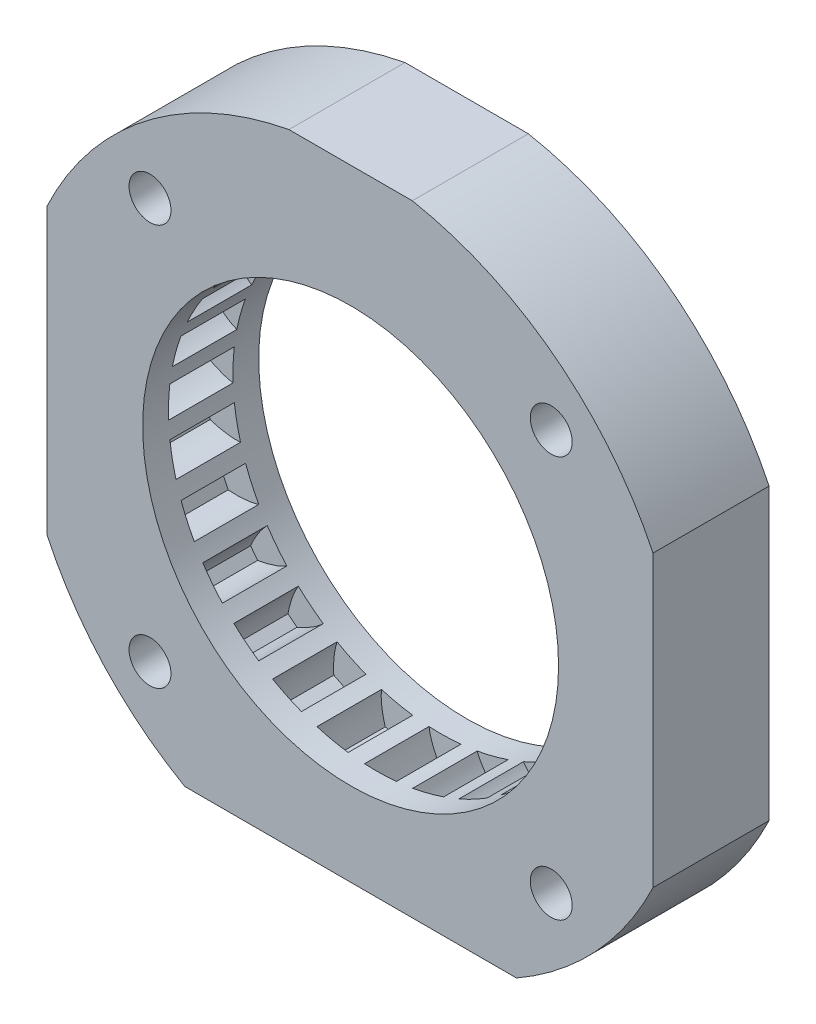
from build123d import *

# Parameters (mm, degrees)
CROQUIS77_R                 = 26
CROQUIS77_R_2               = 16.125
CROQUIS77_R_3               = 1.625
SALIENTE_EXTRUIR1_DEPTH     = 9
CORTAR_EXTRUIR34_DEPTH      = 2.5
CORTAR_EXTRUIR34_DEPTH_BACK = 2.5
CORTAR_EXTRUIR35_DEPTH      = 289.830326754
CROQUIS84_R                 = 1.625
SALIENTE_EXTRUIR2_DEPTH     = 9
CORTAR_EXTRUIR36_DEPTH      = 289.61594127


with BuildPart() as part:
    # Croquis77 → Saliente-Extruir1 (new body)
    with BuildSketch(Plane(origin=(0, -88.245525224, 0), x_dir=(1, 0, 0), z_dir=(0, 0, 1))):
        with Locations((226.61482719, 201.987096474)):
            Circle(CROQUIS77_R)
        with Locations((226.61482719, 201.987096474)):
            Circle(CROQUIS77_R_2, mode=Mode.SUBTRACT)
        with Locations((248.61482719, 201.987096474)):
            Circle(CROQUIS77_R_3, mode=Mode.SUBTRACT)
        with Locations((242.171176376, 186.430747288)):
            Circle(CROQUIS77_R_3, mode=Mode.SUBTRACT)
        with Locations((226.61482719, 179.987096474)):
            Circle(CROQUIS77_R_3, mode=Mode.SUBTRACT)
        with Locations((211.058478003, 186.430747288)):
            Circle(CROQUIS77_R_3, mode=Mode.SUBTRACT)
        with Locations((204.61482719, 201.987096474)):
            Circle(CROQUIS77_R_3, mode=Mode.SUBTRACT)
        with Locations((211.058478003, 217.54344566)):
            Circle(CROQUIS77_R_3, mode=Mode.SUBTRACT)
        with Locations((226.61482719, 223.987096474)):
            Circle(CROQUIS77_R_3, mode=Mode.SUBTRACT)
        with Locations((242.171176376, 217.54344566)):
            Circle(CROQUIS77_R_3, mode=Mode.SUBTRACT)
    extrude(amount=SALIENTE_EXTRUIR1_DEPTH)

    # Croquis80 → Cortar-Extruir34 (cut, two sides: drawn at the far end of the back side and taken through both)
    with BuildSketch(Plane(origin=(0, -88.245525224, 4.5), x_dir=(1, 0, 0), z_dir=(0, 0, 1)).offset(-CORTAR_EXTRUIR34_DEPTH_BACK)):
        with BuildLine():
            Line((209.076345498, 207.32663772), (208.83645806, 206.463797463))
            add(Edge.make_bspline(
                [(210.901865378, 205.054739598), (210.81477289, 205.090460196), (210.684168137, 205.142933934), (210.508569892, 205.226843539), (210.364583833, 205.301843923), (210.202459466, 205.393823438), (210.021733392, 205.505267626), (209.822054637, 205.639174671), (209.602681203, 205.798511697), (209.263519123, 206.066501995), (209.009024187, 206.295687384), (208.83645806, 206.463797463)],
                knots=[0, 0, 0, 0, 0.112240047, 0.167638162, 0.231904779, 0.305712064, 0.389762058, 0.484920987, 0.592209309, 0.712851342, 1, 1, 1, 1], degree=3))
            Line((210.901865378, 205.054739598), (211.57264766, 207.467445999))
            add(Edge.make_bspline(
                [(211.57264766, 207.467445999), (211.47961584, 207.481803684), (211.340668669, 207.504270956), (211.146959049, 207.523036576), (210.984923748, 207.53311646), (210.798589266, 207.538015712), (210.586275802, 207.535844644), (210.346135245, 207.524216465), (210.076000604, 207.500972808), (209.647185976, 207.446495919), (209.310917813, 207.381554891), (209.076345498, 207.32663772)],
                knots=[0, 0, 0, 0, 0.112240047, 0.167638162, 0.231904779, 0.305712064, 0.389762058, 0.484920987, 0.592209309, 0.712851342, 1, 1, 1, 1], degree=3))
        make_face()
        with BuildLine():
            Line((210.780746184, 211.227251372), (210.348340286, 210.442990936))
            add(Edge.make_bspline(
                [(212.033123177, 208.595598701), (211.956616015, 208.650441356), (211.841633006, 208.731620186), (211.690118921, 208.853763739), (211.567310305, 208.959947948), (211.430767956, 209.086836596), (211.280614176, 209.236955092), (211.117198877, 209.413301745), (210.94048433, 209.618934817), (210.672267223, 209.95791756), (210.477486019, 210.239615798), (210.348340286, 210.442990936)],
                knots=[0, 0, 0, 0, 0.112240047, 0.167638162, 0.231904779, 0.305712064, 0.389762058, 0.484920987, 0.592209309, 0.712851342, 1, 1, 1, 1], degree=3))
            Line((212.033123177, 208.595598701), (213.242232823, 210.788577249))
            add(Edge.make_bspline(
                [(213.242232823, 210.788577249), (213.155019798, 210.824002535), (213.024999275, 210.877907622), (212.840838773, 210.940839925), (212.685495736, 210.988016015), (212.505313769, 211.035754896), (212.298222559, 211.082605205), (212.061873379, 211.126670689), (211.793659897, 211.166350903), (211.363840787, 211.212233904), (211.021660344, 211.226592145), (210.780746184, 211.227251372)],
                knots=[0, 0, 0, 0, 0.112240047, 0.167638162, 0.231904779, 0.305712064, 0.389762058, 0.484920987, 0.592209309, 0.712851342, 1, 1, 1, 1], degree=3))
        make_face()
        with BuildLine():
            Line((213.338747944, 214.62966163), (212.7371347, 213.966260698))
            add(Edge.make_bspline(
                [(213.95046608, 211.780127486), (213.888668765, 211.851135616), (213.795506265, 211.956643167), (213.676244504, 212.110435877), (213.581233973, 212.242079493), (213.477634678, 212.397036674), (213.366148019, 212.577736552), (213.247805938, 212.787015919), (213.123277004, 213.027859304), (212.940464525, 213.419559845), (212.815897758, 213.738584508), (212.7371347, 213.966260698)],
                knots=[0, 0, 0, 0, 0.112240047, 0.167638162, 0.231904779, 0.305712064, 0.389762058, 0.484920987, 0.592209309, 0.712851342, 1, 1, 1, 1], degree=3))
            Line((213.95046608, 211.780127486), (215.632719676, 213.63515414))
            add(Edge.make_bspline(
                [(215.632719676, 213.63515414), (215.556027123, 213.68973724), (215.441942689, 213.772174105), (215.277259445, 213.875880394), (215.136983255, 213.957609417), (214.97266746, 214.045614311), (214.781962844, 214.138960283), (214.562146687, 214.236343848), (214.310313821, 214.336808763), (213.90266189, 214.48057809), (213.573016203, 214.573461543), (213.338747944, 214.62966163)],
                knots=[0, 0, 0, 0, 0.112240047, 0.167638162, 0.231904779, 0.305712064, 0.389762058, 0.484920987, 0.592209309, 0.712851342, 1, 1, 1, 1], degree=3))
        make_face()
        with BuildLine():
            Line((216.612448239, 217.350443675), (215.874060774, 216.843666364))
            add(Edge.make_bspline(
                [(216.550529636, 214.436647183), (216.506773678, 214.519992721), (216.440454101, 214.644141053), (216.359874095, 214.821291916), (216.297783693, 214.971297998), (216.232712515, 215.145969929), (216.165903254, 215.347509611), (216.099014242, 215.578439388), (216.033384308, 215.841509157), (215.945831924, 216.264810819), (215.898195021, 216.603963204), (215.874060774, 216.843666364)],
                knots=[0, 0, 0, 0, 0.112240047, 0.167638162, 0.231904779, 0.305712064, 0.389762058, 0.484920987, 0.592209309, 0.712851342, 1, 1, 1, 1], degree=3))
            Line((216.550529636, 214.436647183), (218.615236456, 215.853716975))
            add(Edge.make_bspline(
                [(218.615236456, 215.853716975), (218.55319889, 215.924515301), (218.461200866, 216.03103975), (218.324872995, 216.169929193), (218.207225978, 216.281805115), (218.067634662, 216.405331656), (217.903597577, 216.540140986), (217.712164788, 216.685592659), (217.490288914, 216.841426184), (217.126780781, 217.075331196), (216.827441135, 217.241732491), (216.612448239, 217.350443675)],
                knots=[0, 0, 0, 0, 0.112240047, 0.167638162, 0.231904779, 0.305712064, 0.389762058, 0.484920987, 0.592209309, 0.712851342, 1, 1, 1, 1], degree=3))
        make_face()
        with BuildLine():
            Line((220.42536104, 219.242919445), (219.590006013, 218.920086249))
            add(Edge.make_bspline(
                [(219.693143746, 216.421944127), (219.669788038, 216.513133893), (219.63388669, 216.649230138), (219.596332529, 216.840188905), (219.570509565, 217.000470585), (219.547474508, 217.185440658), (219.528944349, 217.396955088), (219.517114411, 217.637085791), (219.513921604, 217.908199784), (219.526349287, 218.340282264), (219.558210366, 218.681278579), (219.590006013, 218.920086249)],
                knots=[0, 0, 0, 0, 0.112240047, 0.167638162, 0.231904779, 0.305712064, 0.389762058, 0.484920987, 0.592209309, 0.712851342, 1, 1, 1, 1], degree=3))
            Line((219.693143746, 216.421944127), (222.02899491, 217.324662458))
            add(Edge.make_bspline(
                [(222.02899491, 217.324662458), (221.984956792, 217.407859253), (221.920004815, 217.532728526), (221.81938179, 217.699313557), (221.730706326, 217.835305118), (221.623364893, 217.987693958), (221.49483862, 218.156699041), (221.342109391, 218.342377484), (221.162151893, 218.545178595), (220.862384378, 218.856609411), (220.60948825, 219.087557811), (220.42536104, 219.242919445)],
                knots=[0, 0, 0, 0, 0.112240047, 0.167638162, 0.231904779, 0.305712064, 0.389762058, 0.484920987, 0.592209309, 0.712851342, 1, 1, 1, 1], degree=3))
        make_face()
        with BuildLine():
            Line((224.57193123, 220.205065079), (223.684642848, 220.083580021))
            add(Edge.make_bspline(
                [(223.208889268, 217.628990445), (223.207192925, 217.723108376), (223.203645256, 217.86381555), (223.211141495, 218.058287584), (223.222978091, 218.220204036), (223.243220982, 218.405500467), (223.27396889, 218.615586847), (223.31783578, 218.851972966), (223.377252225, 219.116515359), (223.488989996, 219.534084979), (223.598631417, 219.858542023), (223.684642848, 220.083580021)],
                knots=[0, 0, 0, 0, 0.112240047, 0.167638162, 0.231904779, 0.305712064, 0.389762058, 0.484920987, 0.592209309, 0.712851342, 1, 1, 1, 1], degree=3))
            Line((223.208889268, 217.628990445), (225.689958436, 217.968691537))
            add(Edge.make_bspline(
                [(225.689958436, 217.968691537), (225.666293872, 218.05980164), (225.631889521, 218.196284003), (225.572395954, 218.381583979), (225.517472562, 218.534359839), (225.448167816, 218.707395656), (225.362081239, 218.901485383), (225.256289242, 219.117380624), (225.127951677, 219.35621626), (224.908085322, 219.728383565), (224.715266409, 220.011428581), (224.57193123, 220.205065079)],
                knots=[0, 0, 0, 0, 0.112240047, 0.167638162, 0.231904779, 0.305712064, 0.389762058, 0.484920987, 0.592209309, 0.712851342, 1, 1, 1, 1], degree=3))
        make_face()
        with BuildLine():
            Line((228.828616137, 220.185011059), (227.937228346, 220.271423429))
            add(Edge.make_bspline(
                [(226.908231453, 217.992713958), (226.928285923, 218.084686132), (226.95728319, 218.222418675), (227.009425704, 218.409919938), (227.058283747, 218.564742205), (227.120713286, 218.740375614), (227.199081633, 218.937708133), (227.296280476, 219.157606033), (227.415103018, 219.401315276), (227.620127065, 219.781860749), (227.80163803, 220.07228696), (227.937228346, 220.271423429)],
                knots=[0, 0, 0, 0, 0.112240047, 0.167638162, 0.231904779, 0.305712064, 0.389762058, 0.484920987, 0.592209309, 0.712851342, 1, 1, 1, 1], degree=3))
            Line((226.908231453, 217.992713958), (229.400763543, 217.751084437))
            add(Edge.make_bspline(
                [(229.400763543, 217.751084437), (229.398748297, 217.845196079), (229.396746318, 217.985933732), (229.381589524, 218.179959084), (229.363379136, 218.341283057), (229.335847314, 218.525637446), (229.296841384, 218.73434839), (229.243689893, 218.96882146), (229.173890971, 219.23081593), (229.04577883, 219.643656088), (228.923432048, 219.963538691), (228.828616137, 220.185011059)],
                knots=[0, 0, 0, 0, 0.112240047, 0.167638162, 0.231904779, 0.305712064, 0.389762058, 0.484920987, 0.592209309, 0.712851342, 1, 1, 1, 1], degree=3))
        make_face()
        with BuildLine():
            Line((232.965936776, 219.183838501), (232.118504522, 219.473489786))
            add(Edge.make_bspline(
                [(230.591737805, 217.493506238), (230.632461948, 217.578374411), (230.692440899, 217.705707125), (230.786418672, 217.876129377), (230.869664212, 218.015510949), (230.970914806, 218.172012895), (231.092678735, 218.345953305), (231.237969517, 218.537508233), (231.409792401, 218.747245898), (231.697049823, 219.07025192), (231.940645031, 219.310990345), (232.118504522, 219.473489786)],
                knots=[0, 0, 0, 0, 0.112240047, 0.167638162, 0.231904779, 0.305712064, 0.389762058, 0.484920987, 0.592209309, 0.712851342, 1, 1, 1, 1], degree=3))
            Line((230.591737805, 217.493506238), (232.961359768, 216.683572413))
            add(Edge.make_bspline(
                [(232.961359768, 216.683572413), (232.981102481, 216.775612012), (233.011610802, 216.913017751), (233.041607887, 217.105308522), (233.061092231, 217.266483591), (233.076817581, 217.452217958), (233.086995117, 217.664298459), (233.089349542, 217.904708854), (233.081852142, 218.175737968), (233.052400773, 218.606994659), (233.007121869, 218.946469895), (232.965936776, 219.183838501)],
                knots=[0, 0, 0, 0, 0.112240047, 0.167638162, 0.231904779, 0.305712064, 0.389762058, 0.484920987, 0.592209309, 0.712851342, 1, 1, 1, 1], degree=3))
        make_face()
        with BuildLine():
            Line((236.760849121, 217.255520876), (236.003057697, 217.732795901))
            add(Edge.make_bspline(
                [(234.060829544, 216.158279702), (234.120027909, 216.231468609), (234.207755065, 216.341536955), (234.338501731, 216.485692687), (234.451646979, 216.602119468), (234.586260183, 216.731052889), (234.744855369, 216.872224019), (234.930405426, 217.025109199), (235.145965636, 217.189568274), (235.499970312, 217.437621506), (235.792517481, 217.615693875), (236.003057697, 217.732795901)],
                knots=[0, 0, 0, 0, 0.112240047, 0.167638162, 0.231904779, 0.305712064, 0.389762058, 0.484920987, 0.592209309, 0.712851342, 1, 1, 1, 1], degree=3))
            Line((234.060829544, 216.158279702), (236.179794446, 214.823705316))
            add(Edge.make_bspline(
                [(236.179794446, 214.823705316), (236.220230784, 214.908710993), (236.281604693, 215.035377239), (236.355138506, 215.215566983), (236.411267176, 215.367904159), (236.46940194, 215.545005517), (236.528214268, 215.749022259), (236.585947683, 215.982409393), (236.641155991, 216.247861901), (236.711953124, 216.674285966), (236.746183097, 217.015052636), (236.760849121, 217.255520876)],
                knots=[0, 0, 0, 0, 0.112240047, 0.167638162, 0.231904779, 0.305712064, 0.389762058, 0.484920987, 0.592209309, 0.712851342, 1, 1, 1, 1], degree=3))
        make_face()
        with BuildLine():
            Line((240.008768464, 214.504014289), (239.381470601, 215.143183032))
            add(Edge.make_bspline(
                [(237.128487036, 214.059016758), (237.202968225, 214.116580766), (237.313714192, 214.203450931), (237.474181164, 214.31356867), (237.611126431, 214.400764062), (237.771845211, 214.495178126), (237.958721747, 214.595969402), (238.174528026, 214.701942755), (238.422204656, 214.812257208), (238.823872102, 214.971985037), (239.149599939, 215.077791422), (239.381470601, 215.143183032)],
                knots=[0, 0, 0, 0, 0.112240047, 0.167638162, 0.231904779, 0.305712064, 0.389762058, 0.484920987, 0.592209309, 0.712851342, 1, 1, 1, 1], degree=3))
            Line((237.128487036, 214.059016758), (238.88256093, 212.271749061))
            add(Edge.make_bspline(
                [(238.88256093, 212.271749061), (238.94151096, 212.345138138), (239.030441774, 212.454236282), (239.143548088, 212.612610924), (239.233295173, 212.747897669), (239.330705291, 212.906818438), (239.434981824, 213.091772825), (239.544981804, 213.305554737), (239.659919526, 213.551120027), (239.827148471, 213.949722833), (239.939041972, 214.273410119), (240.008768464, 214.504014289)],
                knots=[0, 0, 0, 0, 0.112240047, 0.167638162, 0.231904779, 0.305712064, 0.389762058, 0.484920987, 0.592209309, 0.712851342, 1, 1, 1, 1], degree=3))
        make_face()
        with BuildLine():
            Line((242.534598634, 211.07765317), (242.071612122, 211.84425788))
            add(Edge.make_bspline(
                [(239.629332071, 211.308889215), (239.715080784, 211.347725033), (239.842875217, 211.406713824), (240.02441168, 211.476857095), (240.177774211, 211.530120372), (240.355934177, 211.58492519), (240.561017499, 211.63990293), (240.795445829, 211.693251404), (241.061886567, 211.743474156), (241.489562788, 211.806265612), (241.83091122, 211.834101964), (242.071612122, 211.84425788)],
                knots=[0, 0, 0, 0, 0.112240047, 0.167638162, 0.231904779, 0.305712064, 0.389762058, 0.484920987, 0.592209309, 0.712851342, 1, 1, 1, 1], degree=3))
            Line((239.629332071, 211.308889215), (240.92395238, 209.165280271))
            add(Edge.make_bspline(
                [(240.92395238, 209.165280271), (240.99823809, 209.223096324), (241.109931526, 209.308744856), (241.256512751, 209.436766378), (241.375039962, 209.547709349), (241.506474029, 209.679882069), (241.650593192, 209.835803164), (241.80692961, 210.018454815), (241.975400424, 210.230894398), (242.230045824, 210.580187165), (242.413570647, 210.869345001), (242.534598634, 211.07765317)],
                knots=[0, 0, 0, 0, 0.112240047, 0.167638162, 0.231904779, 0.305712064, 0.389762058, 0.484920987, 0.592209309, 0.712851342, 1, 1, 1, 1], degree=3))
        make_face()
        with BuildLine():
            Line((244.202171472, 207.161153534), (243.928456034, 208.013866353))
            add(Edge.make_bspline(
                [(241.428543447, 208.05615716), (241.520936948, 208.07417114), (241.658890417, 208.102098456), (241.851709692, 208.128485816), (242.013221673, 208.144945541), (242.199218176, 208.157186573), (242.41145219, 208.163386912), (242.651864479, 208.161234477), (242.922705435, 208.148658005), (243.353334295, 208.111127985), (243.69190114, 208.059493639), (243.928456034, 208.013866353)],
                knots=[0, 0, 0, 0, 0.112240047, 0.167638162, 0.231904779, 0.305712064, 0.389762058, 0.484920987, 0.592209309, 0.712851342, 1, 1, 1, 1], degree=3))
            Line((241.428543447, 208.05615716), (242.193916855, 205.671769483))
            add(Edge.make_bspline(
                [(242.193916855, 205.671769483), (242.279533483, 205.710895632), (242.407968119, 205.768477218), (242.580122022, 205.859243947), (242.721039527, 205.93986218), (242.879411899, 206.038161385), (243.05560419, 206.156643441), (243.249848909, 206.298318034), (243.46277051, 206.466179237), (243.791104366, 206.747331502), (244.03636664, 206.986371314), (244.202171472, 207.161153534)],
                knots=[0, 0, 0, 0, 0.112240047, 0.167638162, 0.231904779, 0.305712064, 0.389762058, 0.484920987, 0.592209309, 0.712851342, 1, 1, 1, 1], degree=3))
        make_face()
        with BuildLine():
            Line((244.921587694, 202.965654891), (244.8518994, 203.85850585))
            add(Edge.make_bspline(
                [(242.429125212, 204.476176221), (242.523182544, 204.472397223), (242.663857942, 204.467757496), (242.857565092, 204.448966396), (243.018519371, 204.427735221), (243.20232529, 204.396752548), (243.410268405, 204.353841225), (243.643703964, 204.29630392), (243.904344034, 204.221606225), (244.314710218, 204.085777983), (244.632243251, 203.957456559), (244.8518994, 203.85850585)],
                knots=[0, 0, 0, 0, 0.112240047, 0.167638162, 0.231904779, 0.305712064, 0.389762058, 0.484920987, 0.592209309, 0.712851342, 1, 1, 1, 1], degree=3))
            Line((242.429125212, 204.476176221), (242.62399024, 201.979552767))
            add(Edge.make_bspline(
                [(242.62399024, 201.979552767), (242.716322172, 201.997879713), (242.854574063, 202.024290114), (243.043019784, 202.072908792), (243.198730683, 202.118856136), (243.375503464, 202.177982492), (243.574270311, 202.252638109), (243.795951549, 202.345697931), (244.041845278, 202.459931312), (244.426167027, 202.657786084), (244.719944599, 202.833821174), (244.921587694, 202.965654891)],
                knots=[0, 0, 0, 0, 0.112240047, 0.167638162, 0.231904779, 0.305712064, 0.389762058, 0.484920987, 0.592209309, 0.712851342, 1, 1, 1, 1], degree=3))
        make_face()
        with BuildLine():
            Line((244.654063386, 198.717337659), (244.79215915, 199.602192931))
            add(Edge.make_bspline(
                [(242.577135744, 200.761944096), (242.667786252, 200.736575848), (242.803599732, 200.699619206), (242.987751955, 200.636662679), (243.139471444, 200.578885182), (243.311177755, 200.50634909), (243.503619704, 200.416639464), (243.717493962, 200.30681914), (243.953881971, 200.174027194), (244.321862533, 199.947223265), (244.601243465, 199.749132605), (244.79215915, 199.602192931)],
                knots=[0, 0, 0, 0, 0.112240047, 0.167638162, 0.231904779, 0.305712064, 0.389762058, 0.484920987, 0.592209309, 0.712851342, 1, 1, 1, 1], degree=3))
            Line((242.577135744, 200.761944096), (242.190987169, 198.287678482))
            add(Edge.make_bspline(
                [(242.190987169, 198.287678482), (242.285056766, 198.284218214), (242.425672718, 198.278033639), (242.620251098, 198.28188322), (242.782360977, 198.290682643), (242.9680043, 198.307448631), (243.178630132, 198.334253108), (243.415796995, 198.373681278), (243.681406658, 198.428128487), (244.100997414, 198.532019363), (244.427452659, 198.635559634), (244.654063386, 198.717337659)],
                knots=[0, 0, 0, 0, 0.112240047, 0.167638162, 0.231904779, 0.305712064, 0.389762058, 0.484920987, 0.592209309, 0.712851342, 1, 1, 1, 1], degree=3))
        make_face()
        with BuildLine():
            Line((243.414020852, 194.645229718), (243.752455897, 195.474386527))
            add(Edge.make_bspline(
                [(241.864595758, 197.113696001), (241.946952449, 197.068106112), (242.07058227, 197.000824896), (242.235251873, 196.897096946), (242.369557336, 196.805887927), (242.519907306, 196.695708854), (242.686473494, 196.564037195), (242.869256434, 196.407854293), (243.068648643, 196.224126946), (243.374405657, 195.918574388), (243.600572989, 195.66139361), (243.752455897, 195.474386527)],
                knots=[0, 0, 0, 0, 0.112240047, 0.167638162, 0.231904779, 0.305712064, 0.389762058, 0.484920987, 0.592209309, 0.712851342, 1, 1, 1, 1], degree=3))
            Line((241.864595758, 197.113696001), (240.918250949, 194.795176527))
            add(Edge.make_bspline(
                [(240.918250949, 194.795176527), (241.008986895, 194.770115589), (241.144386264, 194.73166945), (241.334607534, 194.690542402), (241.494377006, 194.661719525), (241.678882793, 194.635221287), (241.890012715, 194.612729585), (242.129879477, 194.596400522), (242.400885987, 194.588126296), (242.833125505, 194.592452492), (243.174659137, 194.617916061), (243.414020852, 194.645229718)],
                knots=[0, 0, 0, 0, 0.112240047, 0.167638162, 0.231904779, 0.305712064, 0.389762058, 0.484920987, 0.592209309, 0.712851342, 1, 1, 1, 1], degree=3))
        make_face()
        with BuildLine():
            Line((241.268311107, 190.968859463), (241.788840311, 191.69761775))
            add(Edge.make_bspline(
                [(240.329918468, 193.728109935), (240.399541472, 193.664756167), (240.504322719, 193.570777527), (240.64063232, 193.431870153), (240.750283314, 193.312146713), (240.871171539, 193.170264442), (241.00288234, 193.003729203), (241.144720086, 192.809603585), (241.29636721, 192.584845624), (241.523417234, 192.217016855), (241.684178228, 191.914610642), (241.788840311, 191.69761775)],
                knots=[0, 0, 0, 0, 0.112240047, 0.167638162, 0.231904779, 0.305712064, 0.389762058, 0.484920987, 0.592209309, 0.712851342, 1, 1, 1, 1], degree=3))
            Line((240.329918468, 193.728109935), (238.874395119, 191.690328585))
            add(Edge.make_bspline(
                [(238.874395119, 191.690328585), (238.956905815, 191.645018019), (239.079789187, 191.576382957), (239.255398468, 191.49249645), (239.404214321, 191.427605122), (239.577635816, 191.359271185), (239.777887761, 191.288695839), (240.007523141, 191.217489845), (240.269316468, 191.14694025), (240.690902604, 191.05146854), (241.029102455, 190.99748266), (241.268311107, 190.968859463)],
                knots=[0, 0, 0, 0, 0.112240047, 0.167638162, 0.231904779, 0.305712064, 0.389762058, 0.484920987, 0.592209309, 0.712851342, 1, 1, 1, 1], degree=3))
        make_face()
        with BuildLine():
            Line((238.332609919, 187.886420965), (239.007171417, 188.475493182))
            add(Edge.make_bspline(
                [(238.055838724, 190.787703719), (238.108974647, 190.71000149), (238.189258537, 190.594391838), (238.289859649, 190.427793573), (238.368944861, 190.286010035), (238.453854225, 190.120073475), (238.543609075, 189.927652614), (238.636855117, 189.706049642), (238.732581821, 189.452377827), (238.868684531, 189.042102591), (238.955372519, 188.71077374), (239.007171417, 188.475493182)],
                knots=[0, 0, 0, 0, 0.112240047, 0.167638162, 0.231904779, 0.305712064, 0.389762058, 0.484920987, 0.592209309, 0.712851342, 1, 1, 1, 1], degree=3))
            Line((238.055838724, 190.787703719), (236.169604475, 189.140517814))
            add(Edge.make_bspline(
                [(236.169604475, 189.140517814), (236.23944175, 189.077400323), (236.34318445, 188.982276473), (236.4947146, 188.860152851), (236.624554132, 188.762691379), (236.777542138, 188.656205643), (236.956120471, 188.541351388), (237.163144767, 188.419107198), (237.401611565, 188.29008558), (237.7898165, 188.099962868), (238.10645013, 187.969437931), (238.332609919, 187.886420965)],
                knots=[0, 0, 0, 0, 0.112240047, 0.167638162, 0.231904779, 0.305712064, 0.389762058, 0.484920987, 0.592209309, 0.712851342, 1, 1, 1, 1], degree=3))
        make_face()
        with BuildLine():
            Line((234.765181698, 185.564089281), (235.557409706, 185.981718394))
            add(Edge.make_bspline(
                [(235.164952755, 188.450995413), (235.198737025, 188.363133671), (235.250195431, 188.232125552), (235.309664624, 188.046817753), (235.35392055, 187.890617703), (235.398273566, 187.709572538), (235.441233758, 187.501639513), (235.480861179, 187.264505861), (235.515506811, 186.995595705), (235.553324873, 186.564992046), (235.561266484, 186.222602582), (235.557409706, 185.981718394)],
                knots=[0, 0, 0, 0, 0.112240047, 0.167638162, 0.231904779, 0.305712064, 0.389762058, 0.484920987, 0.592209309, 0.712851342, 1, 1, 1, 1], degree=3))
            Line((235.164952755, 188.450995413), (232.949694982, 187.283205171))
            add(Edge.make_bspline(
                [(232.949694982, 187.283205171), (233.003093889, 187.205683437), (233.082103122, 187.089198949), (233.201385111, 186.935421927), (233.30524864, 186.810644485), (233.429555533, 186.671747624), (233.57683305, 186.518806283), (233.75008553, 186.352114112), (233.952369992, 186.17157606), (234.286265498, 185.897051912), (234.564263105, 185.697024551), (234.765181698, 185.564089281)],
                knots=[0, 0, 0, 0, 0.112240047, 0.167638162, 0.231904779, 0.305712064, 0.389762058, 0.484920987, 0.592209309, 0.712851342, 1, 1, 1, 1], degree=3))
        make_face()
        with BuildLine():
            Line((230.758347422, 184.127061914), (231.625532723, 184.350733428))
            add(Edge.make_bspline(
                [(231.81310897, 186.843957567), (231.825720269, 186.750672961), (231.845579056, 186.611329058), (231.860710329, 186.417301714), (231.86775112, 186.255105938), (231.869156707, 186.068712359), (231.863006246, 185.856476894), (231.846878721, 185.616596498), (231.818575525, 185.346945018), (231.756070159, 184.919226891), (231.684837259, 184.584235117), (231.625532723, 184.350733428)],
                knots=[0, 0, 0, 0, 0.112240047, 0.167638162, 0.231904779, 0.305712064, 0.389762058, 0.484920987, 0.592209309, 0.712851342, 1, 1, 1, 1], degree=3))
            Line((231.81310897, 186.843957567), (229.388252794, 186.218518863))
            add(Edge.make_bspline(
                [(229.388252794, 186.218518863), (229.422334584, 186.130772101), (229.472350941, 185.999206685), (229.552954248, 185.822066423), (229.625242463, 185.676699795), (229.714166827, 185.512879774), (229.822203759, 185.330096453), (229.952344336, 185.12794272), (230.107541253, 184.905621088), (230.369126937, 184.561495171), (230.593501599, 184.302748913), (230.758347422, 184.127061914)],
                knots=[0, 0, 0, 0, 0.112240047, 0.167638162, 0.231904779, 0.305712064, 0.389762058, 0.484920987, 0.592209309, 0.712851342, 1, 1, 1, 1], degree=3))
        make_face()
        with BuildLine():
            Line((226.528116566, 183.652809381), (227.423508976, 183.670465107))
            add(Edge.make_bspline(
                [(228.181006137, 186.053226007), (228.171764585, 185.959547534), (228.15895316, 185.819379913), (228.128930783, 185.62709309), (228.098376869, 185.467645603), (228.056759251, 185.285952137), (228.001829709, 185.0808559), (227.930816677, 184.851160774), (227.841090487, 184.595304951), (227.681631373, 184.193530751), (227.535064145, 183.883996161), (227.423508976, 183.670465107)],
                knots=[0, 0, 0, 0, 0.112240047, 0.167638162, 0.231904779, 0.305712064, 0.389762058, 0.484920987, 0.592209309, 0.712851342, 1, 1, 1, 1], degree=3))
            Line((228.181006137, 186.053226007), (225.677276181, 186.003856403))
            add(Edge.make_bspline(
                [(225.677276181, 186.003856403), (225.690203496, 185.910615065), (225.708530583, 185.771061446), (225.746109861, 185.58010762), (225.782925686, 185.421988559), (225.831673586, 185.242076958), (225.894645634, 185.039305555), (225.974658395, 184.812588419), (226.074401063, 184.560468623), (226.249574773, 184.165292854), (226.408230394, 183.861776777), (226.528116566, 183.652809381)],
                knots=[0, 0, 0, 0, 0.112240047, 0.167638162, 0.231904779, 0.305712064, 0.389762058, 0.484920987, 0.592209309, 0.712851342, 1, 1, 1, 1], degree=3))
        make_face()
        with BuildLine():
            Line((222.302541969, 184.166898759), (223.177870651, 183.977586872))
            add(Edge.make_bspline(
                [(224.464451858, 186.121429277), (224.433855671, 186.032407168), (224.389064702, 185.8989723), (224.315507188, 185.71879223), (224.249005738, 185.570688889), (224.166608531, 185.403490677), (224.065861175, 185.21659046), (223.943790967, 185.009463527), (223.797478945, 184.781196614), (223.549662565, 184.427026092), (223.335662486, 184.159635776), (223.177870651, 183.977586872)],
                knots=[0, 0, 0, 0, 0.112240047, 0.167638162, 0.231904779, 0.305712064, 0.389762058, 0.484920987, 0.592209309, 0.712851342, 1, 1, 1, 1], degree=3))
            Line((224.464451858, 186.121429277), (222.016824853, 186.6507903))
            add(Edge.make_bspline(
                [(222.016824853, 186.6507903), (222.007900778, 186.557081051), (221.993550576, 186.4170626), (221.986079917, 186.222589582), (221.985438602, 186.060242327), (221.991382026, 185.873938227), (222.00589435, 185.662110199), (222.031465788, 185.423052041), (222.070377053, 185.154725924), (222.149695129, 184.729804332), (222.234078542, 184.397881066), (222.302541969, 184.166898759)],
                knots=[0, 0, 0, 0, 0.112240047, 0.167638162, 0.231904779, 0.305712064, 0.389762058, 0.484920987, 0.592209309, 0.712851342, 1, 1, 1, 1], degree=3))
        make_face()
        with BuildLine():
            Line((218.309425451, 185.641615356), (219.11750121, 185.25554171))
            add(Edge.make_bspline(
                [(220.863806536, 187.044890519), (220.813505163, 186.965323979), (220.739149342, 186.845815374), (220.626022197, 186.687455611), (220.527158321, 186.558680704), (220.40842358, 186.414991445), (220.267289726, 186.256363087), (220.100743178, 186.082970615), (219.905733043, 185.894598541), (219.582919242, 185.607125121), (219.313023112, 185.396294161), (219.11750121, 185.25554171)],
                knots=[0, 0, 0, 0, 0.112240047, 0.167638162, 0.231904779, 0.305712064, 0.389762058, 0.484920987, 0.592209309, 0.712851342, 1, 1, 1, 1], degree=3))
            Line((220.863806536, 187.044890519), (218.604234688, 188.124444181))
            add(Edge.make_bspline(
                [(218.604234688, 188.124444181), (218.573940323, 188.035318909), (218.527686455, 187.902384059), (218.475568605, 187.714875939), (218.437504723, 187.557052672), (218.400323258, 187.374399776), (218.365593496, 187.164934828), (218.335345047, 186.926423333), (218.311327192, 186.656356426), (218.290513576, 186.224596643), (218.296075651, 185.882160258), (218.309425451, 185.641615356)],
                knots=[0, 0, 0, 0, 0.112240047, 0.167638162, 0.231904779, 0.305712064, 0.389762058, 0.484920987, 0.592209309, 0.712851342, 1, 1, 1, 1], degree=3))
        make_face()
        with BuildLine():
            Line((214.764036959, 187.997456819), (215.46129622, 187.435434743))
            add(Edge.make_bspline(
                [(217.573181895, 188.773825701), (217.505887094, 188.708004182), (217.405974963, 188.608864579), (217.2593769, 188.480862339), (217.133480375, 188.378358155), (216.984809121, 188.265924175), (216.810897331, 188.144119371), (216.608853012, 188.013808993), (216.375657809, 187.875486944), (215.995249564, 187.670208394), (215.684007554, 187.52730274), (215.46129622, 187.435434743)],
                knots=[0, 0, 0, 0, 0.112240047, 0.167638162, 0.231904779, 0.305712064, 0.389762058, 0.484920987, 0.592209309, 0.712851342, 1, 1, 1, 1], degree=3))
            Line((217.573181895, 188.773825701), (215.623479305, 190.345372983))
            add(Edge.make_bspline(
                [(215.623479305, 190.345372983), (215.573447826, 190.265636456), (215.497783852, 190.146951757), (215.403828496, 189.976517146), (215.330394081, 189.831726162), (215.252092191, 189.662571333), (215.169992633, 189.466761775), (215.085554998, 189.241655161), (214.999902833, 188.984406841), (214.880079593, 188.569085149), (214.806520476, 188.234596478), (214.764036959, 187.997456819)],
                knots=[0, 0, 0, 0, 0.112240047, 0.167638162, 0.231904779, 0.305712064, 0.389762058, 0.484920987, 0.592209309, 0.712851342, 1, 1, 1, 1], degree=3))
        make_face()
        with BuildLine():
            Line((211.857509302, 191.107419125), (212.406362639, 190.399747375))
            add(Edge.make_bspline(
                [(214.769976358, 191.215027477), (214.689316011, 191.166499435), (214.569233858, 191.093073477), (214.397068017, 191.002329393), (214.250925958, 190.93162196), (214.080333096, 190.856504602), (213.883019, 190.778089882), (213.65636917, 190.697886663), (213.397560515, 190.617071618), (212.980065731, 190.505054557), (212.644256978, 190.43777829), (212.406362639, 190.399747375)],
                knots=[0, 0, 0, 0, 0.112240047, 0.167638162, 0.231904779, 0.305712064, 0.389762058, 0.484920987, 0.592209309, 0.712851342, 1, 1, 1, 1], degree=3))
            Line((214.769976358, 191.215027477), (213.235251999, 193.193845859))
            add(Edge.make_bspline(
                [(213.235251999, 193.193845859), (213.168180617, 193.127796694), (213.067185599, 193.02976047), (212.936457896, 192.885587543), (212.831611816, 192.761634559), (212.716410776, 192.61509698), (212.59136743, 192.443498954), (212.457292665, 192.243932777), (212.31462372, 192.013371367), (212.102250557, 191.636877866), (211.953535839, 191.32836928), (211.857509302, 191.107419125)],
                knots=[0, 0, 0, 0, 0.112240047, 0.167638162, 0.231904779, 0.305712064, 0.389762058, 0.484920987, 0.592209309, 0.712851342, 1, 1, 1, 1], degree=3))
        make_face()
        with BuildLine():
            Line((209.74653414, 194.803843401), (210.117392727, 193.988672744))
            add(Edge.make_bspline(
                [(212.605311463, 194.23689003), (212.515633989, 194.208271624), (212.381855475, 194.164517722), (212.193403361, 194.115923832), (212.034894323, 194.080825005), (211.85157656, 194.047073867), (211.641497412, 194.016276587), (211.402460822, 193.990504305), (211.131991156, 193.971553023), (210.699917085, 193.958836319), (210.357645126, 193.970816321), (210.117392727, 193.988672744)],
                knots=[0, 0, 0, 0, 0.112240047, 0.167638162, 0.231904779, 0.305712064, 0.389762058, 0.484920987, 0.592209309, 0.712851342, 1, 1, 1, 1], degree=3))
            Line((212.605311463, 194.23689003), (211.568302722, 196.516300901))
            add(Edge.make_bspline(
                [(211.568302722, 196.516300901), (211.487807272, 196.467499825), (211.366925879, 196.395397234), (211.206473393, 196.285258389), (211.075867927, 196.188825744), (210.929978254, 196.072805293), (210.76873224, 195.934669694), (210.59224835, 195.771402618), (210.400253944, 195.579957744), (210.106779951, 195.262589296), (209.890926881, 194.996692573), (209.74653414, 194.803843401)],
                knots=[0, 0, 0, 0, 0.112240047, 0.167638162, 0.231904779, 0.305712064, 0.389762058, 0.484920987, 0.592209309, 0.712851342, 1, 1, 1, 1], degree=3))
        make_face()
        with BuildLine():
            Line((208.544914689, 198.887454458), (208.717785445, 198.008730955))
            add(Edge.make_bspline(
                [(211.195884854, 197.676503966), (211.10202479, 197.669338021), (210.961761949, 197.65761496), (210.767183063, 197.653790973), (210.604852311, 197.656192939), (210.418692353, 197.665627553), (210.207173574, 197.684108004), (209.96863675, 197.714156048), (209.701087162, 197.758090198), (209.27772703, 197.845359412), (208.947443834, 197.935949838), (208.717785445, 198.008730955)],
                knots=[0, 0, 0, 0, 0.112240047, 0.167638162, 0.231904779, 0.305712064, 0.389762058, 0.484920987, 0.592209309, 0.712851342, 1, 1, 1, 1], degree=3))
            Line((211.195884854, 197.676503966), (210.712497141, 200.133623696))
            add(Edge.make_bspline(
                [(210.712497141, 200.133623696), (210.622917153, 200.104701587), (210.488666132, 200.062419699), (210.307138898, 199.992252551), (210.157815021, 199.928538953), (209.989101666, 199.849290322), (209.800345797, 199.752064076), (209.590967074, 199.633897871), (209.359997677, 199.491890375), (209.001244111, 199.250756395), (208.729889385, 199.041806097), (208.544914689, 198.887454458)],
                knots=[0, 0, 0, 0, 0.112240047, 0.167638162, 0.231904779, 0.305712064, 0.389762058, 0.484920987, 0.592209309, 0.712851342, 1, 1, 1, 1], degree=3))
        make_face()
        with BuildLine():
            Line((208.317430566, 203.138103765), (208.282993982, 202.243199629))
            add(Edge.make_bspline(
                [(210.617679085, 201.348438808), (210.52469645, 201.363111643), (210.385510888, 201.384051415), (210.19529503, 201.425203484), (210.037893855, 201.464976752), (209.858927635, 201.517088496), (209.657372257, 201.583850391), (209.432194779, 201.668098863), (209.181988938, 201.772549944), (208.790166199, 201.955100371), (208.489677419, 202.119417466), (208.282993982, 202.243199629)],
                knots=[0, 0, 0, 0, 0.112240047, 0.167638162, 0.231904779, 0.305712064, 0.389762058, 0.484920987, 0.592209309, 0.712851342, 1, 1, 1, 1], degree=3))
            Line((210.617679085, 201.348438808), (210.713971956, 203.850803436))
            add(Edge.make_bspline(
                [(210.713971956, 203.850803436), (210.620136711, 203.843319493), (210.479753569, 203.833137735), (210.286937767, 203.806725012), (210.126945568, 203.779165279), (209.944503911, 203.740960782), (209.738414066, 203.689885382), (209.507428171, 203.623190418), (209.249935401, 203.538275962), (208.845242762, 203.386376045), (208.533015183, 203.245636736), (208.317430566, 203.138103765)],
                knots=[0, 0, 0, 0, 0.112240047, 0.167638162, 0.231904779, 0.305712064, 0.389762058, 0.484920987, 0.592209309, 0.712851342, 1, 1, 1, 1], degree=3))
        make_face()
    extrude(amount=CORTAR_EXTRUIR34_DEPTH + CORTAR_EXTRUIR34_DEPTH_BACK, mode=Mode.SUBTRACT)

    # Croquis81 → Cortar-Extruir35 (cut, through all)
    with BuildSketch(Plane.XY.offset(9)):
        Polygon((221.832252958, 139.297920435), (231.397401421, 139.297920435), (229.515026697, 141.707416741), (224.911797451, 141.707416741), align=None)
    extrude(amount=-CORTAR_EXTRUIR35_DEPTH, mode=Mode.SUBTRACT)

    # Croquis84 → Saliente-Extruir2 (add)
    with BuildSketch(Plane(origin=(0, 0, 0), x_dir=(-1, 0, 0), z_dir=(0, 0, -1))):
        with Locations((-226.61482719, 91.741571249)):
            Circle(CROQUIS84_R)
        with Locations((-226.61482719, 135.741571249)):
            Circle(CROQUIS84_R)
        with Locations((-204.61482719, 113.741571249)):
            Circle(CROQUIS84_R)
        with Locations((-248.61482719, 113.741571249)):
            Circle(CROQUIS84_R)
    extrude(amount=-SALIENTE_EXTRUIR2_DEPTH)

    # Croquis82 → Cortar-Extruir36 (cut, through all)
    with BuildSketch(Plane(origin=(0, 0, 0), x_dir=(-1, 0, 0), z_dir=(0, 0, -1))):
        Polygon((-250.065061153, 133.373077627), (-260.895587287, 132.904571802), (-262.160062069, 84.462106878), (-192.020170036, 84.462106878), (-192.526743902, 133.820225954), (-203.065957709, 133.543059443), (-203.066370098, 91.144153272), (-250.060254399, 91.14411566), align=None)
    extrude(amount=-CORTAR_EXTRUIR36_DEPTH, mode=Mode.SUBTRACT)


solid = part.part
